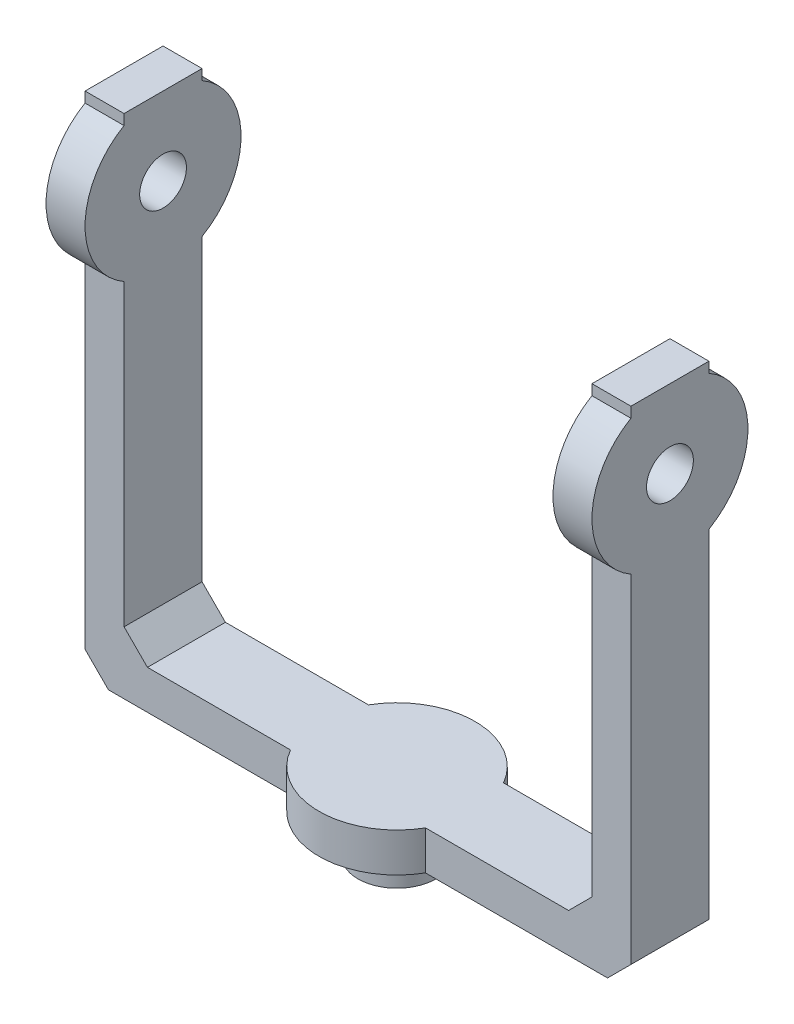
from build123d import *

# Parameters (mm, degrees)
SKETCH1_R           = 250
BOSS_EXTRUDE1_DEPTH = 250
BOSS_EXTRUDE2_DEPTH = 250
SKETCH4_W           = 250
SKETCH4_H           = 500
BOSS_EXTRUDE3_DEPTH = 3250
SKETCH7_R           = 500
BOSS_EXTRUDE4_DEPTH = 250
SKETCH8_R           = 150
CUT_EXTRUDE1_DEPTH  = 250
CHAMFER1_SIZE       = 150


with BuildPart() as part:
    # Sketch1 → Boss-Extrude1 (new body)
    with BuildSketch(Plane(origin=(0, 0, 0), x_dir=(1, 0, 0), z_dir=(0, 1, 0))):
        with Locations(Location((0, 0, 0), (0, 0, 270))):
            Circle(SKETCH1_R)
    extrude(amount=BOSS_EXTRUDE1_DEPTH)

    # Sketch2 → Boss-Extrude2 (add)
    with BuildSketch(Plane(origin=(0, 250, 0), x_dir=(1, 0, 0), z_dir=(0, 1, 0))):
        with BuildLine():
            Line((-433.012701892, 250), (-1500, 250))
            Line((-1500, 250), (-1500, -250))
            Line((-1500, -250), (-433.012701892, -250))
            ThreePointArc((-433.012701892, -250), (0, -500), (433.012701892, -250))
            Line((433.012701892, -250), (1500, -250))
            Line((1500, -250), (1500, 250))
            Line((1500, 250), (433.012701892, 250))
            ThreePointArc((433.012701892, 250), (0, 500), (-433.012701892, 250))
        make_face()
    extrude(amount=BOSS_EXTRUDE2_DEPTH)

    # Sketch4 → Boss-Extrude3 (add)
    with BuildSketch(Plane(origin=(0, 250, 0), x_dir=(1, 0, 0), z_dir=(0, 1, 0))):
        with Locations((1625, 0)):
            Rectangle(SKETCH4_W, SKETCH4_H)
    boss_extrude3 = extrude(amount=BOSS_EXTRUDE3_DEPTH)

    # Sketch7 → Boss-Extrude4 (add)
    with BuildSketch(Plane.ZY.offset(-1500)):
        with Locations((0, 3000)):
            Circle(SKETCH7_R)
    boss_extrude4 = extrude(amount=-BOSS_EXTRUDE4_DEPTH)

    # Sketch8 → Cut-Extrude1 (cut)
    with BuildSketch(Plane.ZY.offset(-1500)):
        with Locations((0, 3000)):
            Circle(SKETCH8_R)
    cut_extrude1 = extrude(amount=-CUT_EXTRUDE1_DEPTH, mode=Mode.SUBTRACT)

    # Mirror1: Boss-Extrude3, Boss-Extrude4, Cut-Extrude1 across plane
    add(boss_extrude3.mirror(Plane(origin=(0, 0, 0), x_dir=(0, 0, 1), z_dir=(1, 0, 0))))
    add(boss_extrude4.mirror(Plane(origin=(0, 0, 0), x_dir=(0, 0, 1), z_dir=(1, 0, 0))))
    add(cut_extrude1.mirror(Plane(origin=(0, 0, 0), x_dir=(0, 0, 1), z_dir=(1, 0, 0))), mode=Mode.SUBTRACT)

    # Chamfer1
    chamfer1_edges = [part.edges().sort_by_distance(p)[0] for p in [
        (1500, 500, 0),
        (-1500, 500, 0),
        (1750, 250, 0),
        (-1750, 250, 0),
    ]]
    chamfer(chamfer1_edges, length=CHAMFER1_SIZE)


solid = part.part
